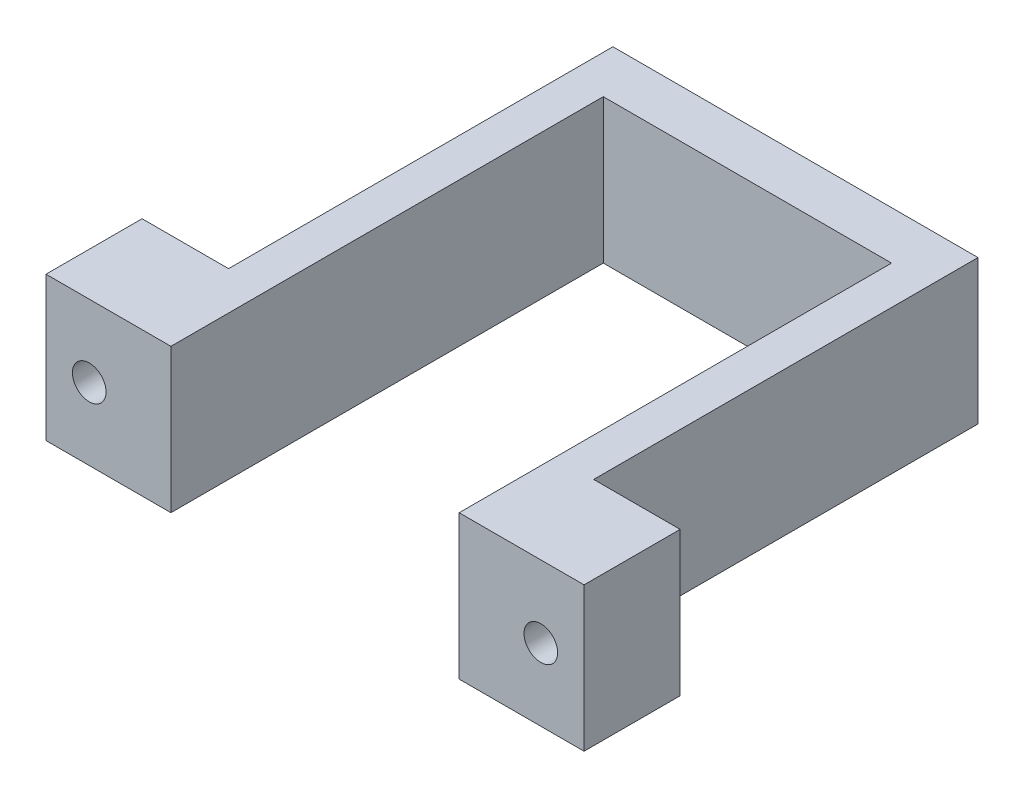
from build123d import *

# Parameters (mm, degrees)
BOSS_EXTRUDE1_DEPTH = 15
SKETCH8_R           = 1.75
CUT_EXTRUDE5_DEPTH  = 52.078371156


with BuildPart() as part:
    # Sketch1 → Boss-Extrude1 (new body)
    with BuildSketch(Plane(origin=(0, 0, 0), x_dir=(1, 0, 0), z_dir=(0, 1, 0))):
        Polygon((-28, 0), (-28, 10), (-19, 10), (-19, 50), (19, 50), (19, 10), (28, 10), (28, 0), (15, 0), (15, 45), (-15, 45), (-15, 0), align=None)
    extrude(amount=BOSS_EXTRUDE1_DEPTH)

    # Sketch8 → Cut-Extrude5 (cut, through all)
    with BuildSketch(Plane(origin=(0, 0, -10), x_dir=(-1, 0, 0), z_dir=(0, 0, -1))):
        with Locations((-23.5, 7.5)):
            Circle(SKETCH8_R)
        with Locations((23.5, 7.5)):
            Circle(SKETCH8_R)
    extrude(amount=-CUT_EXTRUDE5_DEPTH, mode=Mode.SUBTRACT)


solid = part.part
